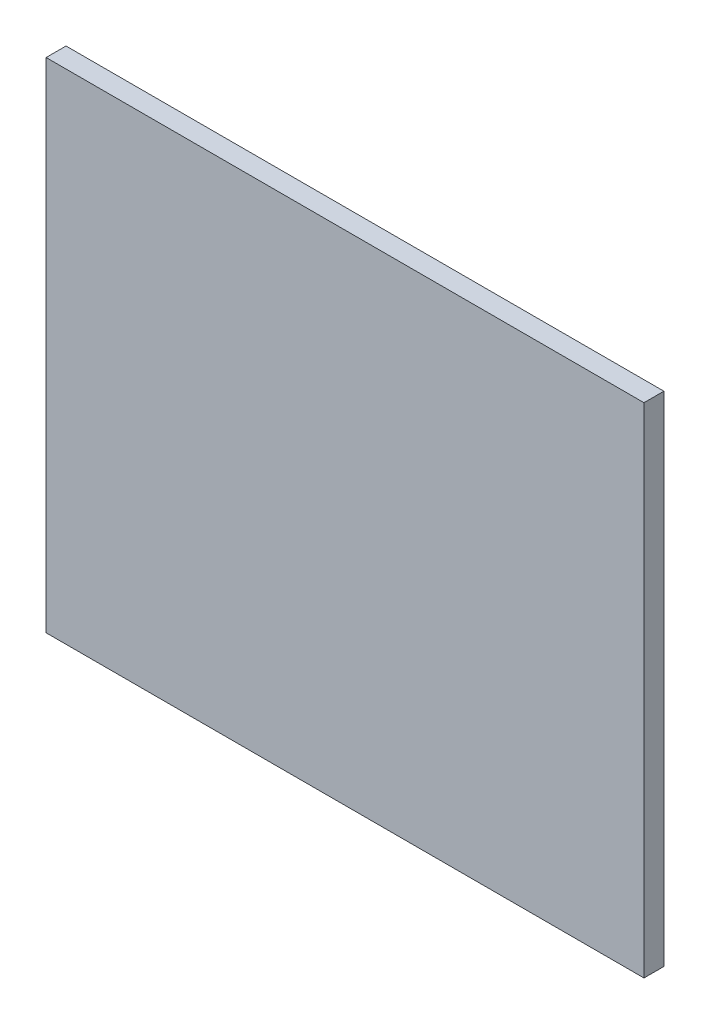
from build123d import *

# Parameters (mm, degrees)
CROQUIS1_W              = 60
CROQUIS1_H              = 50
SALIENTE_EXTRUIR1_DEPTH = 2


with BuildPart() as part:
    # Croquis1 → Saliente-Extruir1 (new body)
    with BuildSketch(Plane.XY):
        Rectangle(CROQUIS1_W, CROQUIS1_H)
    extrude(amount=SALIENTE_EXTRUIR1_DEPTH)


solid = part.part
